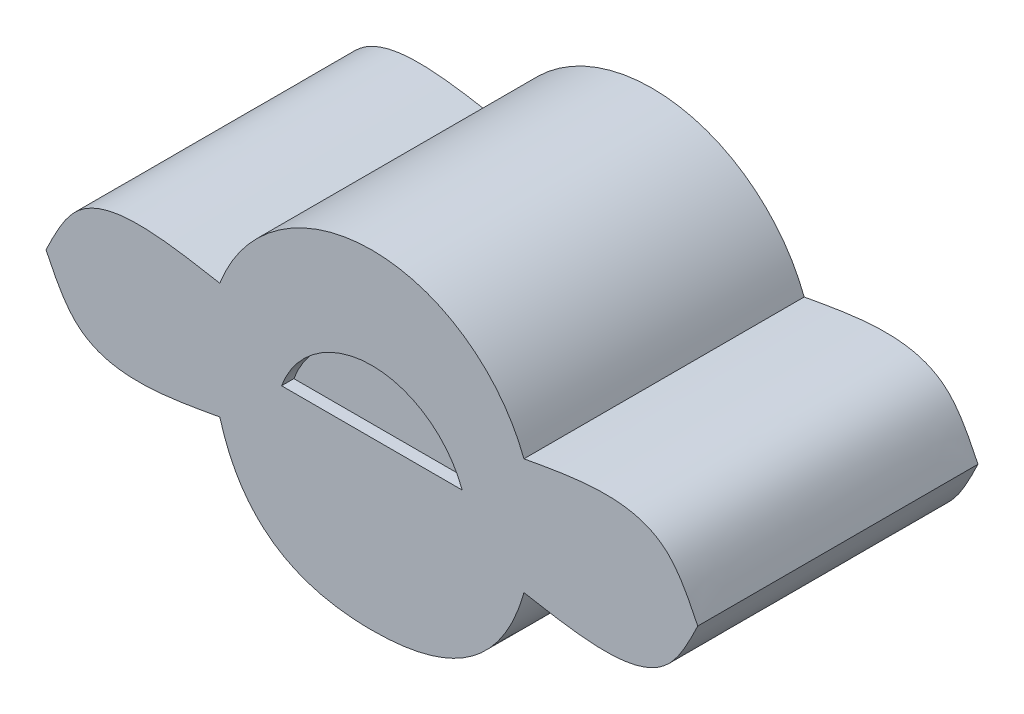
from build123d import *

# Parameters (mm, degrees)
BOSS_EXTRUDE1_DEPTH = 9.8298
BOSS_EXTRUDE2_DEPTH = 9.398


with BuildPart() as part:
    # Sketch1 → Boss-Extrude1 (new body)
    with BuildSketch(Plane.XY):
        with BuildLine():
            ThreePointArc((-5.334, 4.097406167), (0, 7.773346251), (5.334, 4.097406167))
            add(Edge.make_bspline(
                [(11.43, 2.065406167), (11.121896508, 2.700954922), (10.031780776, 4.949620435), (7.296324223, 4.453387168), (5.334, 4.097406167)],
                knots=[0, 0, 0, 0, 0.282633745, 1, 1, 1, 1], degree=3))
            add(Edge.make_bspline(
                [(11.43, 2.065406167), (11.121896508, 1.429857412), (10.031780776, -0.818808101), (7.296324223, -0.322574834), (5.334, 0.033406167)],
                knots=[0, 0, 0, 0, 0.282633745, 1, 1, 1, 1], degree=3))
            add(Edge.make_bspline(
                [(5.334, 0.033406167), (4.599476343, -2.579906525), (2.822016903, -3.776593833), (0, -3.776593833)],
                knots=[0, 0, 0, 0, 1, 1, 1, 1], degree=3))
            add(Edge.make_bspline(
                [(-5.334, 0.033406167), (-4.599476343, -2.579906525), (-2.822016903, -3.776593833), (0, -3.776593833)],
                knots=[0, 0, 0, 0, 1, 1, 1, 1], degree=3))
            add(Edge.make_bspline(
                [(-11.43, 2.065406167), (-11.121896508, 1.429857412), (-10.031780776, -0.818808101), (-7.296324223, -0.322574834), (-5.334, 0.033406167)],
                knots=[0, 0, 0, 0, 0.282633745, 1, 1, 1, 1], degree=3))
            add(Edge.make_bspline(
                [(-11.43, 2.065406167), (-11.121896508, 2.700954922), (-10.031780776, 4.949620435), (-7.296324223, 4.453387168), (-5.334, 4.097406167)],
                knots=[0, 0, 0, 0, 0.282633745, 1, 1, 1, 1], degree=3))
        make_face()
        with BuildLine():
            Line((-3.167940084, 2.065406167), (3.167940084, 2.065406167))
            ThreePointArc((3.167940084, 2.065406167), (0, 4.268146251), (-3.167940084, 2.065406167))
        make_face(mode=Mode.SUBTRACT)
    extrude(amount=BOSS_EXTRUDE1_DEPTH)

    # Sketch2 → Boss-Extrude2 (add)
    with BuildSketch(Plane.XY):
        with BuildLine():
            ThreePointArc((-3.167940084, 2.065406167), (0, 4.268146251), (3.167940084, 2.065406167))
            Line((3.167940084, 2.065406167), (-3.167940084, 2.065406167))
        make_face()
    extrude(amount=BOSS_EXTRUDE2_DEPTH)


solid = part.part
